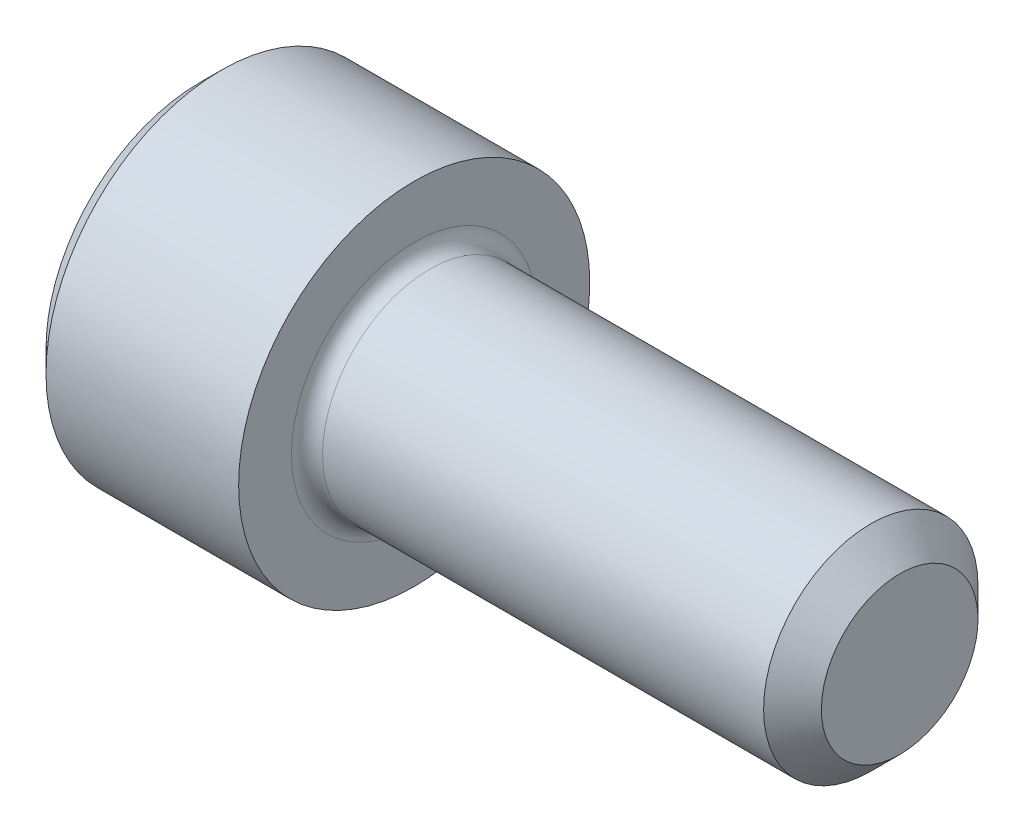
from build123d import *

# Parameters (mm, degrees)
HEX_2_DEPTH   = 1.6256
FILLET1_R     = 0.254
CHAMFER1_SIZE = 0.47244
CHAMFER2_SIZE = 0.3556


with BuildPart() as part:
    # Sketch1 → Base-Revolve (revolve)
    with BuildSketch(Plane.XY):
        Polygon((-3.5052, 0), (-3.5052, 2.8702), (0, 2.8702), (0, 1.7526), (7.9375, 1.7526), (7.9375, 0), align=None)
    revolve(axis=Axis((7.9375, 0, 0), (-1, 0, 0)))

    # Sketch2 → Hex-PreBroach (revolve, cut)
    with BuildSketch(Plane.XY, mode=Mode.PRIVATE) as hex_prebroach_sk:
        Polygon((-3.5052, 1.3843), (-1.8796, 1.3843), (-1.080374022, 0), (-3.5052, 0), align=None)
    revolve(hex_prebroach_sk.sketch.rotate(Axis((7.9375, 0, 0), (-1, 0, 0)), 180), axis=Axis((7.9375, 0, 0), (-1, 0, 0)), mode=Mode.SUBTRACT)

    # Sketch3 → Hex 2 (cut)
    with BuildSketch(Plane(origin=(-3.5052, 0, 0), x_dir=(0, 0.500000000000001, 0.866025403784438), z_dir=(-1, 0, 0))):
        Polygon((0.799225978, 1.3843), (-0.799225978, 1.3843), (-1.598451955, 0), (-0.799225978, -1.3843), (0.799225978, -1.3843), (1.598451955, 0), align=None)
    extrude(amount=-HEX_2_DEPTH, mode=Mode.SUBTRACT)

    # Fillet1
    fillet1_edges = [part.edges().sort_by_distance(p)[0] for p in [
        (0, -1.7526, 0),
    ]]
    fillet(fillet1_edges, radius=FILLET1_R)

    # Chamfer1
    chamfer1_edges = [part.edges().sort_by_distance(p)[0] for p in [
        (7.9375, -1.7526, 0),
    ]]
    chamfer(chamfer1_edges, length=CHAMFER1_SIZE)

    # Chamfer2
    chamfer2_edges = [part.edges().sort_by_distance(p)[0] for p in [
        (-3.5052, -2.8702, 0),
    ]]
    chamfer(chamfer2_edges, length=CHAMFER2_SIZE)


solid = part.part
